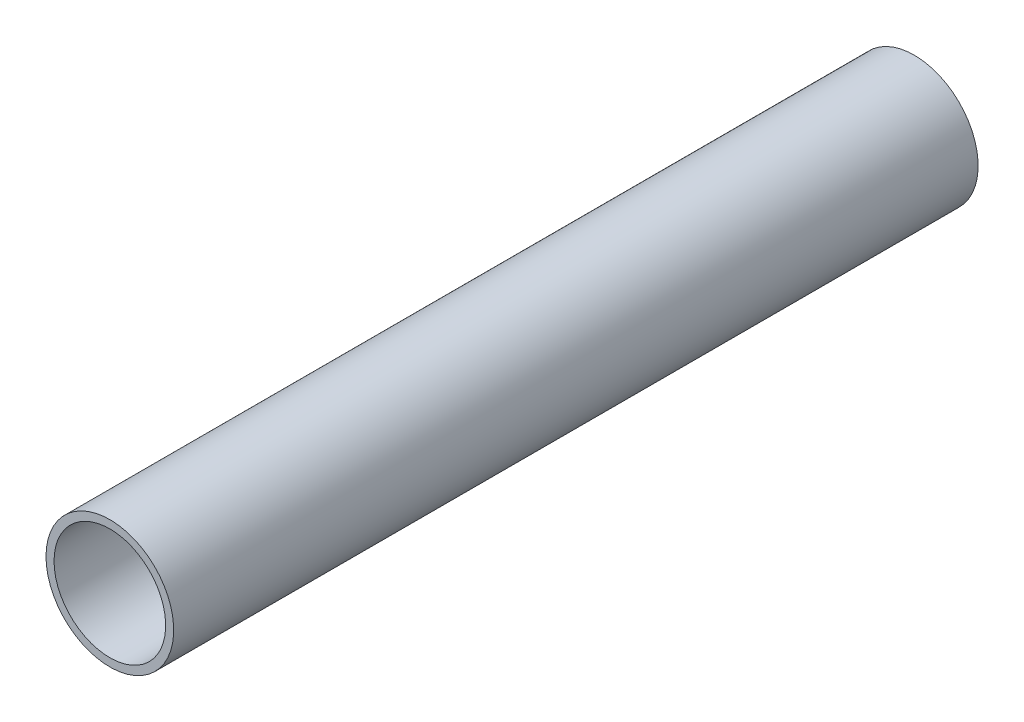
from build123d import *

# Parameters (mm, degrees)
CROQUIS1_R              = 7.9375
CROQUIS1_R_2            = 6.9375
SALIENTE_EXTRUIR1_DEPTH = 50


with BuildPart() as part:
    # Croquis1 → Saliente-Extruir1 (new, symmetric)
    with BuildSketch(Plane.XY):
        with Locations(Location((0, 0, 0), (0, 0, 180))):
            Circle(CROQUIS1_R)
        with Locations(Location((0, 0, 0), (0, 0, 180))):
            Circle(CROQUIS1_R_2, mode=Mode.SUBTRACT)
    extrude(amount=SALIENTE_EXTRUIR1_DEPTH, both=True)


solid = part.part
